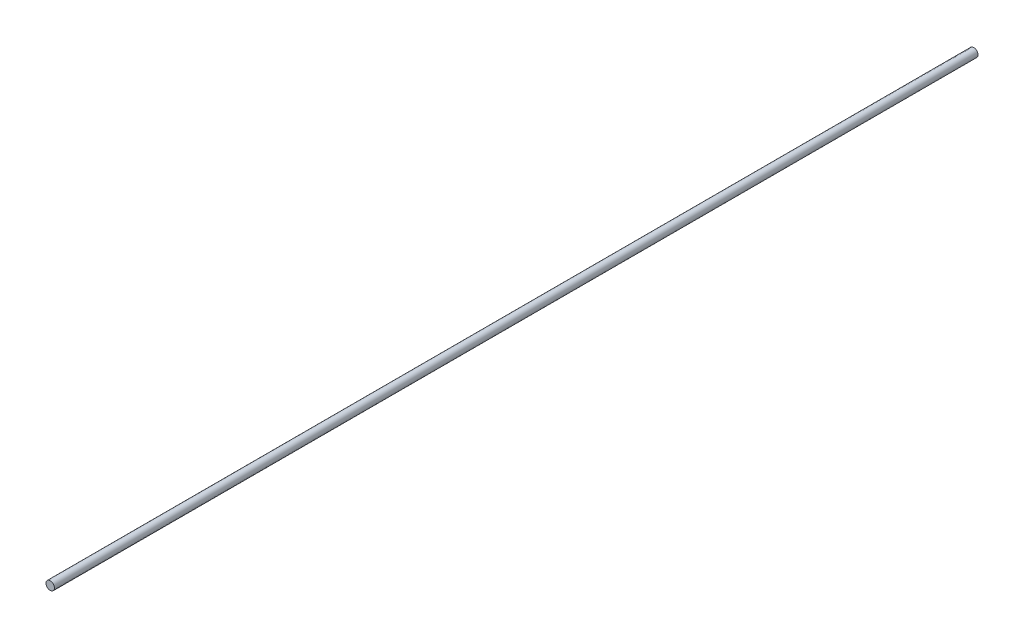
from build123d import *

# Parameters (mm, degrees)
SKETCH1_R           = 4
BOSS_EXTRUDE1_DEPTH = 875


with BuildPart() as part:
    # Sketch1 → Boss-Extrude1 (new body)
    with BuildSketch(Plane.XY):
        Circle(SKETCH1_R)
    extrude(amount=BOSS_EXTRUDE1_DEPTH)


solid = part.part
